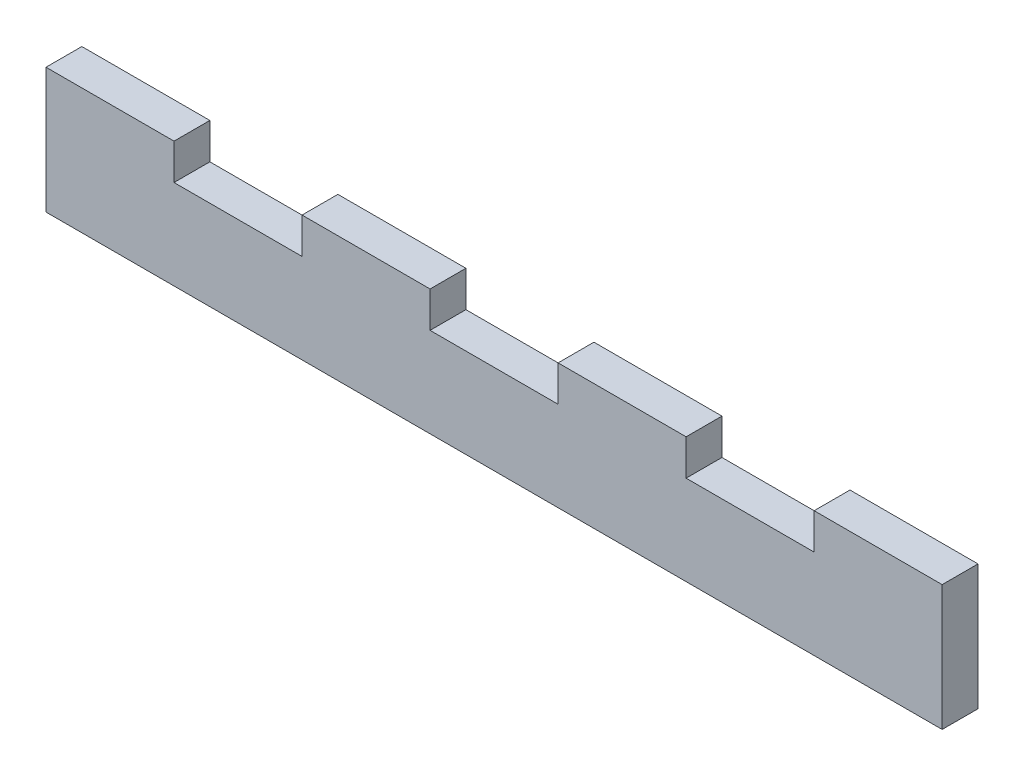
from build123d import *

# Parameters (mm, degrees)
SKETCH1_W           = 127
SKETCH1_H           = 17.78
BOSS_EXTRUDE1_DEPTH = 5.08
SKETCH2_W           = 18.142857143
SKETCH2_H           = 5.08
SKETCH2_W_2         = 18.142857142
CUT_EXTRUDE1_DEPTH  = 5.08


with BuildPart() as part:
    # Sketch1 → Boss-Extrude1 (new body)
    with BuildSketch(Plane.XY):
        Rectangle(SKETCH1_W, SKETCH1_H)
    extrude(amount=BOSS_EXTRUDE1_DEPTH)

    # Sketch2 → Cut-Extrude1 (cut)
    with BuildSketch(Plane(origin=(0, 8.89, 0), x_dir=(1, 0, 0), z_dir=(0, 1, 0))):
        with Locations((36.285714285, -2.54)):
            Rectangle(SKETCH2_W, SKETCH2_H)
        with Locations((0, -2.54)):
            Rectangle(SKETCH2_W_2, SKETCH2_H)
        with Locations((-36.285714285, -2.54)):
            Rectangle(SKETCH2_W, SKETCH2_H)
    extrude(amount=-CUT_EXTRUDE1_DEPTH, mode=Mode.SUBTRACT)


solid = part.part
